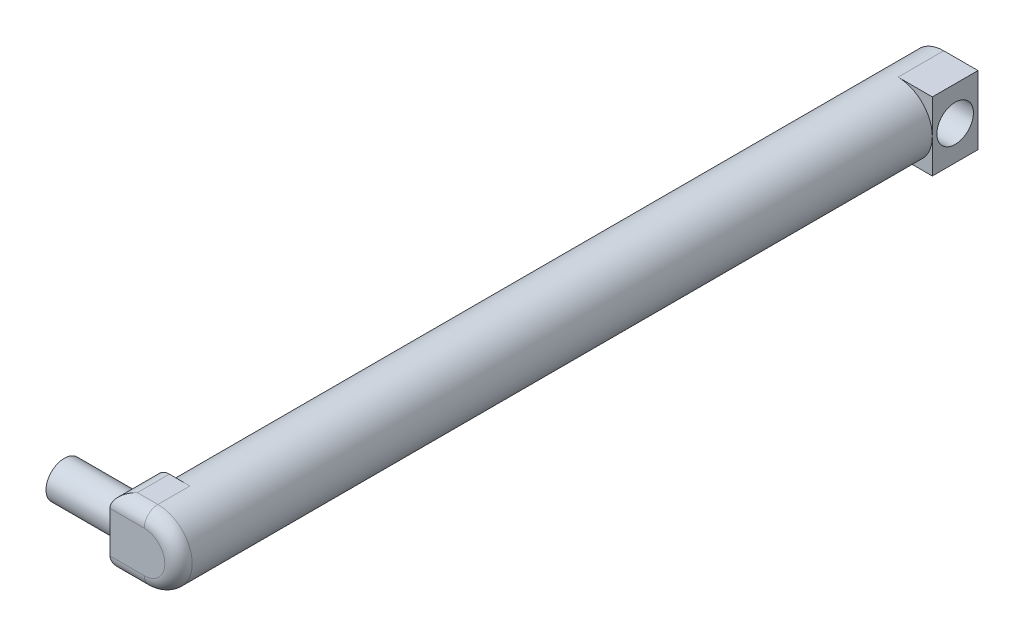
from build123d import *

# Parameters (mm, degrees)
SKETCH_1_R          = 7.5
EXTRUDE_1_DEPTH     = 87.5
SKETCH_2_W          = 10
SKETCH_2_H          = 15
EXTRUDE_2_DEPTH     = 7.5
SKETCH_3_R          = 4
EXTRUDE_3_DEPTH     = 15
SKETCH_4_W          = 10
SKETCH_4_H          = 15
EXTRUDE_4_DEPTH     = 7.5
SKETCH_5_R          = 4
CUT_EXTRUDE_1_DEPTH = 15
FILLET_1_R          = 3


with BuildPart() as part:
    # 草图1 → 凸台-拉伸1 (new, symmetric)
    with BuildSketch(Plane.XY):
        Circle(SKETCH_1_R)
    extrude(amount=EXTRUDE_1_DEPTH, both=True)

    # 草图2 → 凸台-拉伸2 (add)
    with BuildSketch(Plane(origin=(0, 0, 0), x_dir=(0, 0, -1), z_dir=(1, 0, 0))):
        with Locations((-82.5, 0)):
            Rectangle(SKETCH_2_W, SKETCH_2_H)
    extrude(amount=-EXTRUDE_2_DEPTH)

    # 草图3 → 凸台-拉伸3 (add)
    with BuildSketch(Plane.ZY.offset(7.5)):
        with Locations((82.5, 0)):
            Circle(SKETCH_3_R)
    extrude(amount=EXTRUDE_3_DEPTH)

    # 草图4 → 凸台-拉伸4 (add)
    with BuildSketch(Plane(origin=(0, 0, 0), x_dir=(0, 0, -1), z_dir=(1, 0, 0))):
        with Locations((82.5, 0)):
            Rectangle(SKETCH_4_W, SKETCH_4_H)
    extrude(amount=EXTRUDE_4_DEPTH)

    # 草图5 → 切除-拉伸1 (cut)
    with BuildSketch(Plane(origin=(7.5, 0, 0), x_dir=(0, 0, -1), z_dir=(1, 0, 0))):
        with Locations((82.5, 0)):
            Circle(SKETCH_5_R)
    extrude(amount=-CUT_EXTRUDE_1_DEPTH, mode=Mode.SUBTRACT)

    # 圆角1
    fillet_1_edges = [part.edges().sort_by_distance(p)[0] for p in [
        (-3.75, -7.5, 87.5),
        (-7.5, 7.5, 82.5),
        (-3.75, 7.5, 87.5),
        (-7.5, -7.5, 82.5),
        (5.303300859, -5.303300859, 87.5),
    ]]
    fillet(fillet_1_edges, radius=FILLET_1_R)


solid = part.part
